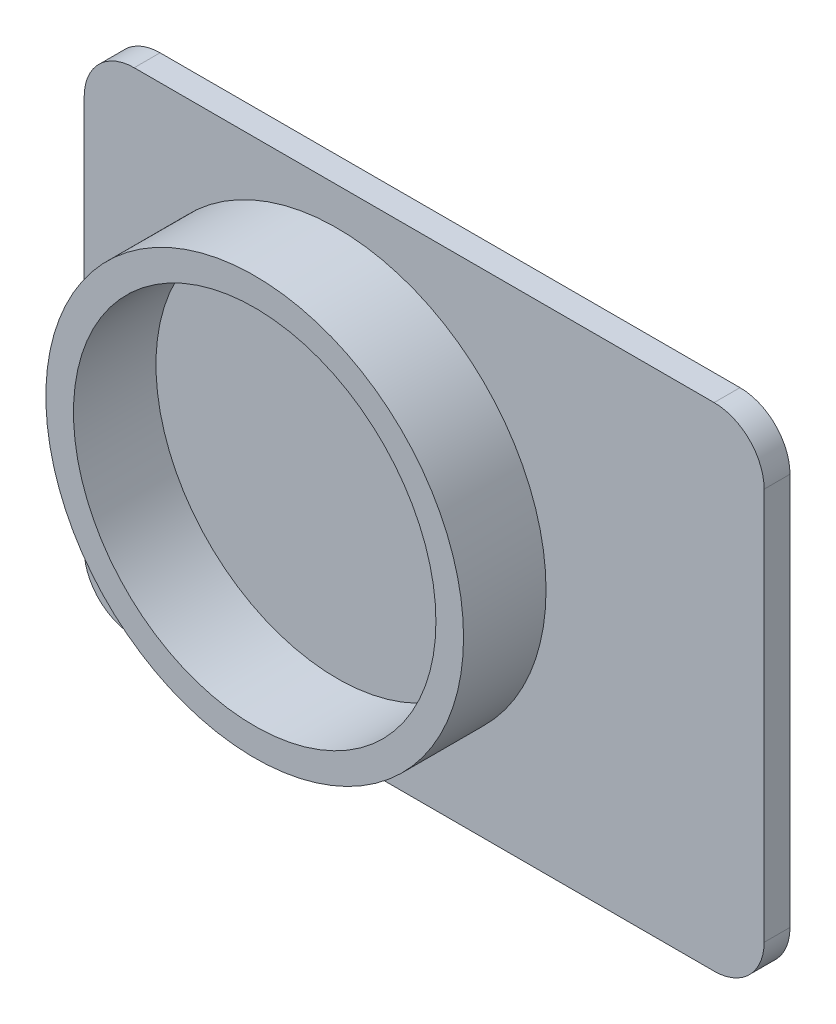
from build123d import *

# Parameters (mm, degrees)
BOSS_EXTRUDE1_DEPTH = 2.07
SKETCH3_R           = 16.71
SKETCH3_R_2         = 14.5
EXTRUDE_THIN1_DEPTH = 8.67


with BuildPart() as part:
    # Sketch1 → Boss-Extrude1 (new body)
    with BuildSketch(Plane.XY):
        with BuildLine():
            Line((23.2, -19.7), (-23.2, -19.7))
            ThreePointArc((-23.2, -19.7), (-26.028427125, -18.528427125), (-27.2, -15.7))
            Line((-27.2, -15.7), (-27.2, 15.7))
            ThreePointArc((-27.2, 15.7), (-26.028427125, 18.528427125), (-23.2, 19.7))
            Line((-23.2, 19.7), (23.2, 19.7))
            ThreePointArc((23.2, 19.7), (26.028427125, 18.528427125), (27.2, 15.7))
            Line((27.2, 15.7), (27.2, -15.7))
            ThreePointArc((27.2, -15.7), (26.028427125, -18.528427125), (23.2, -19.7))
        make_face()
    extrude(amount=BOSS_EXTRUDE1_DEPTH)

    # Sketch3 → Extrude-Thin1 (add)
    with BuildSketch(Plane.XY):
        with Locations((-6.958808182, 0)):
            Circle(SKETCH3_R)
        with Locations((-6.958808182, 0)):
            Circle(SKETCH3_R_2, mode=Mode.SUBTRACT)
    extrude(amount=EXTRUDE_THIN1_DEPTH)


solid = part.part
